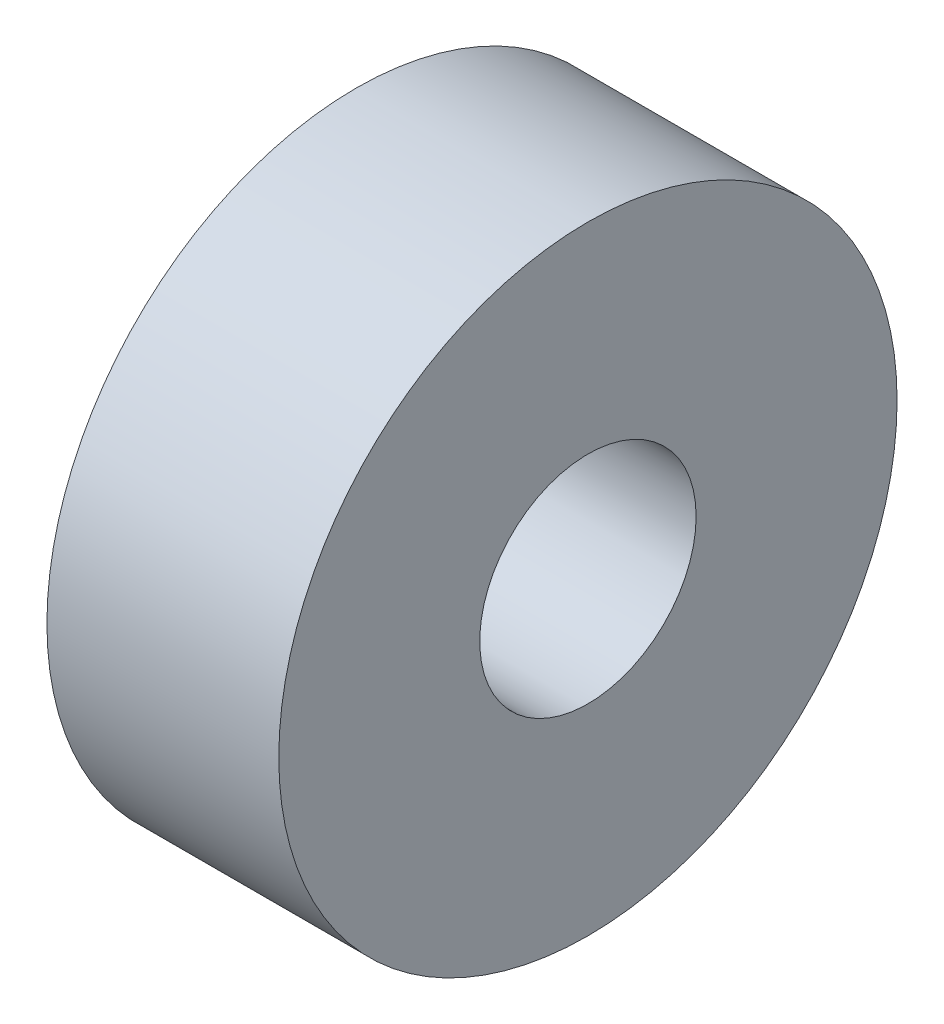
from build123d import *

# Parameters (mm, degrees)
CROQUIS2_R              = 4
CROQUIS2_R_2            = 1.4
SALIENTE_EXTRUIR1_DEPTH = 3


with BuildPart() as part:
    # Croquis2 → Saliente-Extruir1 (new body)
    with BuildSketch(Plane(origin=(0, 0, 0), x_dir=(0, 0, -1), z_dir=(1, 0, 0))):
        Circle(CROQUIS2_R)
        Circle(CROQUIS2_R_2, mode=Mode.SUBTRACT)
    extrude(amount=SALIENTE_EXTRUIR1_DEPTH)


solid = part.part
